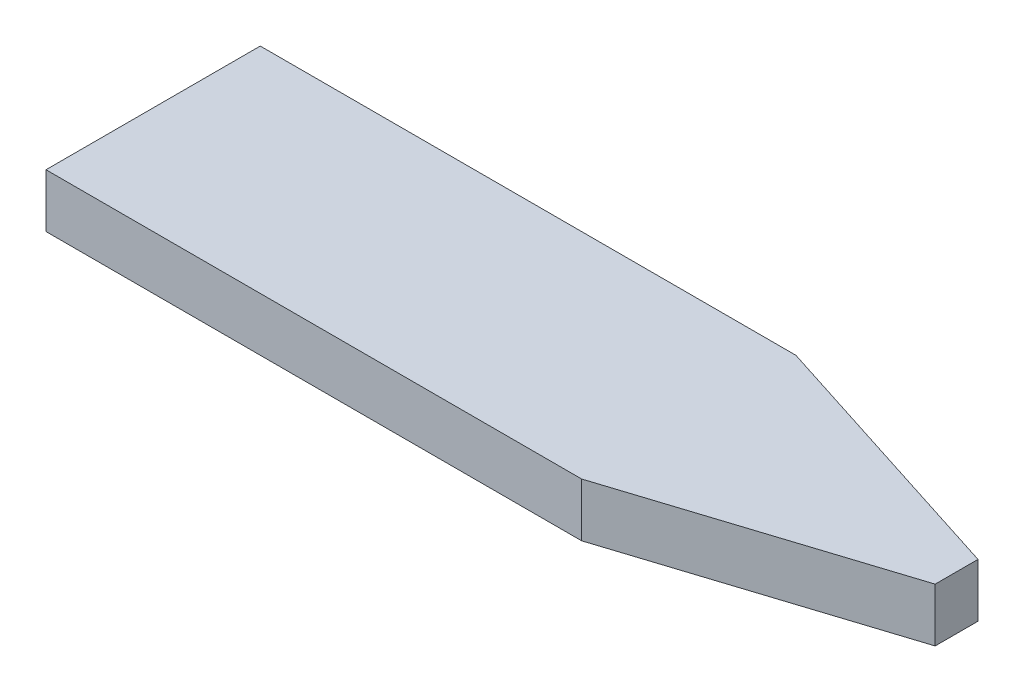
from build123d import *

# Parameters (mm, degrees)
CROQUIS1_W              = 50
CROQUIS1_H              = 20
SALIENTE_EXTRUIR1_DEPTH = 5


with BuildPart() as part:
    # Croquis1 → Saliente-Extruir1 (new body)
    with BuildSketch(Plane(origin=(0, 0, 0), x_dir=(1, 0, 0), z_dir=(0, 1, 0))):
        Rectangle(CROQUIS1_W, CROQUIS1_H)
        Polygon((25, 10), (50, 2), (50, 0), (50, -2), (25, -10), align=None)
    extrude(amount=SALIENTE_EXTRUIR1_DEPTH)


solid = part.part
